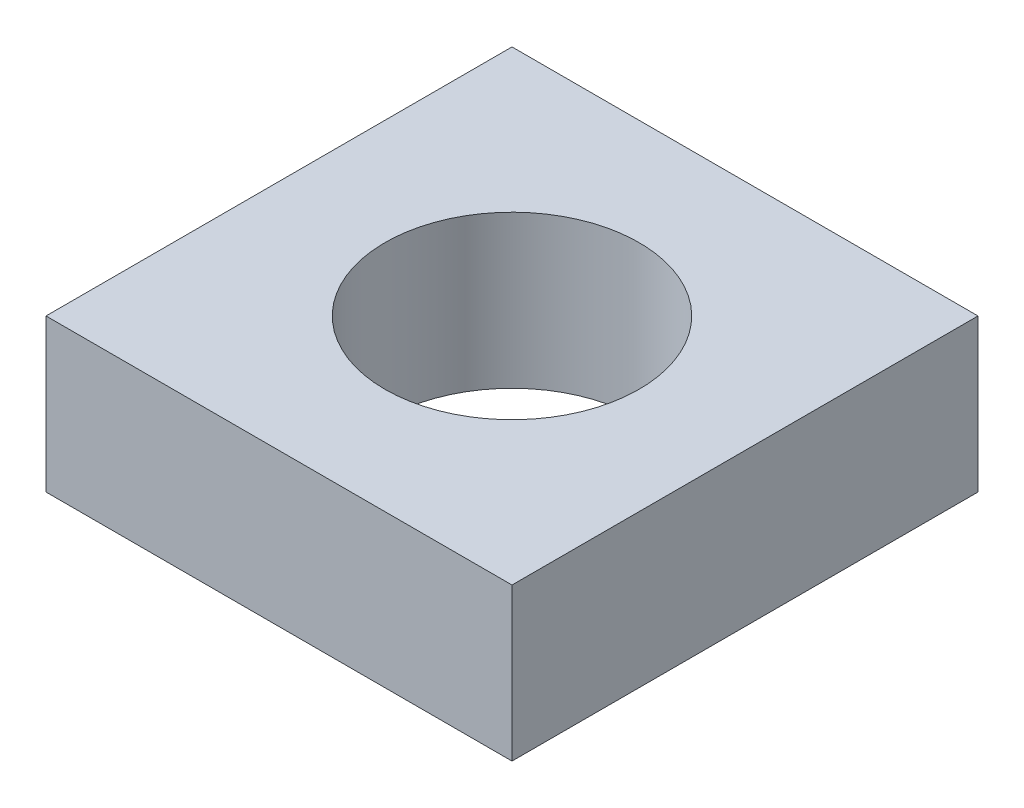
from build123d import *

# Parameters (mm, degrees)
SZKIC1_W                    = 5.5
SZKIC1_H                    = 5.5
SZKIC1_R                    = 1.5
DODANIE_WYCI_GNI_CIE1_DEPTH = 1.8


with BuildPart() as part:
    # Szkic1 → Dodanie-wyciągnięcie1 (new body)
    with BuildSketch(Plane(origin=(0, 0, 0), x_dir=(1, 0, 0), z_dir=(0, 1, 0))):
        with Locations((2.75, 2.75)):
            Rectangle(SZKIC1_W, SZKIC1_H)
        with Locations(Location((2.75, 2.75, 0), (0, 0, 270))):
            Circle(SZKIC1_R, mode=Mode.SUBTRACT)
    extrude(amount=DODANIE_WYCI_GNI_CIE1_DEPTH)


solid = part.part
